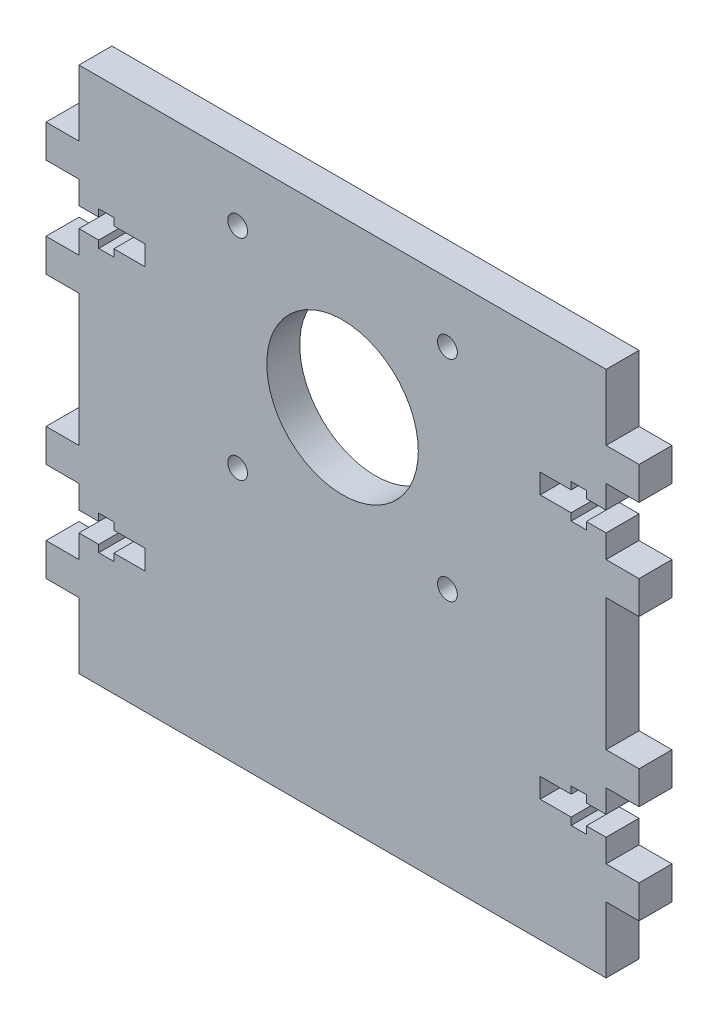
from build123d import *

# Parameters (mm, degrees)
SKETCH1_R           = 1.5
SKETCH1_R_2         = 11.5
BOSS_EXTRUDE1_DEPTH = 5


with BuildPart() as part:
    # Sketch1 → Boss-Extrude1 (new body)
    with BuildSketch(Plane.XY):
        Polygon((0, 80), (-80, 80), (-80, 70), (-85, 70), (-85, 65), (-80, 65), (-80, 61.5), (-77, 61.5), (-77, 62.6), (-74.7, 62.6), (-74.7, 61.5), (-70, 61.5), (-70, 58.5), (-74.7, 58.5), (-74.7, 57.4), (-77, 57.4), (-77, 58.5), (-80, 58.5), (-80, 55), (-85, 55), (-85, 50), (-80, 50), (-80, 30), (-85, 30), (-85, 25), (-80, 25), (-80, 21.5), (-77, 21.5), (-77, 22.6), (-74.7, 22.6), (-74.7, 21.5), (-70, 21.5), (-70, 18.5), (-74.7, 18.5), (-74.7, 17.4), (-77, 17.4), (-77, 18.5), (-80, 18.5), (-80, 15), (-85, 15), (-85, 10), (-80, 10), (-80, 0), (0, 0), (0, 10), (5, 10), (5, 15), (0, 15), (0, 18.5), (-3, 18.5), (-3, 17.4), (-5.3, 17.4), (-5.3, 18.5), (-10, 18.5), (-10, 21.5), (-5.3, 21.5), (-5.3, 22.6), (-3, 22.6), (-3, 21.5), (0, 21.5), (0, 25), (5, 25), (5, 30), (0, 30), (0, 50), (5, 50), (5, 55), (0, 55), (0, 58.5), (-3, 58.5), (-3, 57.4), (-5.3, 57.4), (-5.3, 58.5), (-10, 58.5), (-10, 61.5), (-5.3, 61.5), (-5.3, 62.6), (-3, 62.6), (-3, 61.5), (0, 61.5), (0, 65), (5, 65), (5, 70), (0, 70), align=None)
        with Locations((-55.922, 70.922)):
            Circle(SKETCH1_R, mode=Mode.SUBTRACT)
        with Locations((-24.078, 70.922)):
            Circle(SKETCH1_R, mode=Mode.SUBTRACT)
        with Locations((-24.078, 39.078)):
            Circle(SKETCH1_R, mode=Mode.SUBTRACT)
        with Locations((-55.922, 39.078)):
            Circle(SKETCH1_R, mode=Mode.SUBTRACT)
        with Locations((-40, 55)):
            Circle(SKETCH1_R_2, mode=Mode.SUBTRACT)
    extrude(amount=BOSS_EXTRUDE1_DEPTH)


solid = part.part
